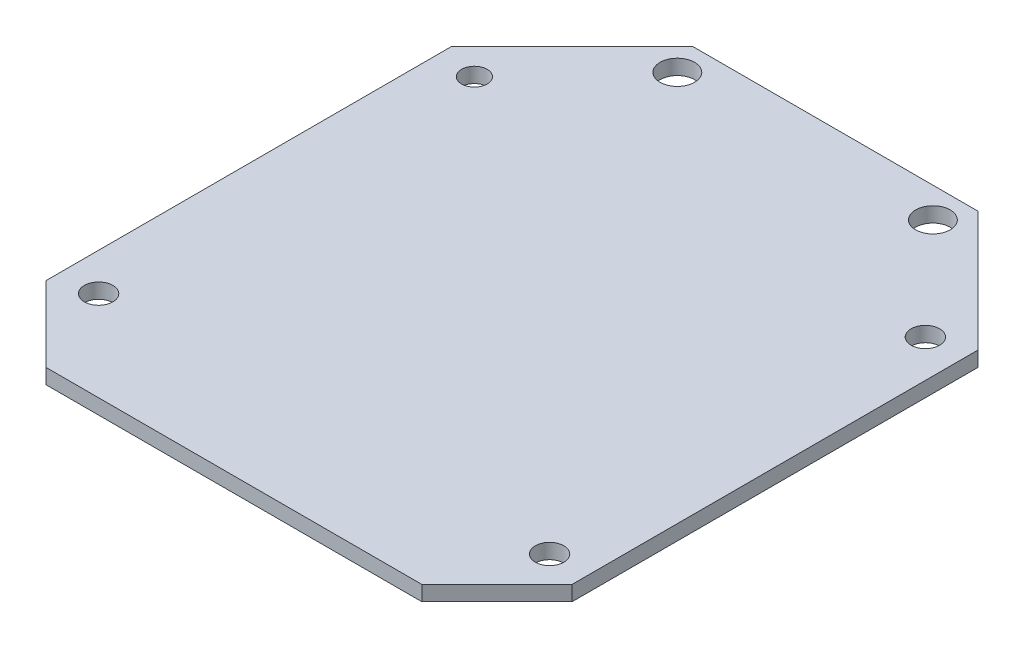
from build123d import *

# Parameters (mm, degrees)
BOSS_EXTRUDE1_DEPTH = 1
SKETCH2_R           = 0.95
SKETCH2_R_2         = 0.85
CUT_EXTRUDE1_DEPTH  = 1
SKETCH3_R           = 1.15
CUT_EXTRUDE2_DEPTH  = 1


with BuildPart() as part:
    # Sketch1 → Boss-Extrude1 (new body)
    with BuildSketch(Plane(origin=(0, 0, 0), x_dir=(1, 0, 0), z_dir=(0, 1, 0))):
        Polygon((30, -6.890061842), (5, -6.890061842), (0, -1.890061842), (0, 25.109938158), (8, 33.109938158), (27, 33.109938158), (35, 25.109938158), (35, -1.890061842), align=None)
    extrude(amount=BOSS_EXTRUDE1_DEPTH)

    # Sketch2 → Cut-Extrude1 (cut)
    with BuildSketch(Plane(origin=(0, 1, 0), x_dir=(1, 0, 0), z_dir=(0, 1, 0))):
        with Locations(Location((32.5, -0.890061842, 0), (0, 0, 270))):
            Circle(SKETCH2_R)
        with Locations(Location((2.5, -0.890061842, 0), (0, 0, 270))):
            Circle(SKETCH2_R)
        with Locations(Location((32.5, 24.109938158, 0), (0, 0, 270))):
            Circle(SKETCH2_R)
        with Locations(Location((2.5, 24.109938158, 0), (0, 0, 270))):
            Circle(SKETCH2_R_2)
    extrude(amount=-CUT_EXTRUDE1_DEPTH, mode=Mode.SUBTRACT)

    # Sketch3 → Cut-Extrude2 (cut)
    with BuildSketch(Plane(origin=(0, 1, 0), x_dir=(1, 0, 0), z_dir=(0, 1, 0))):
        with Locations(Location((26, 31.109938158, 0), (0, 0, 270))):
            Circle(SKETCH3_R)
        with Locations(Location((9, 31.109938158, 0), (0, 0, 270))):
            Circle(SKETCH3_R)
    extrude(amount=-CUT_EXTRUDE2_DEPTH, mode=Mode.SUBTRACT)


solid = part.part
